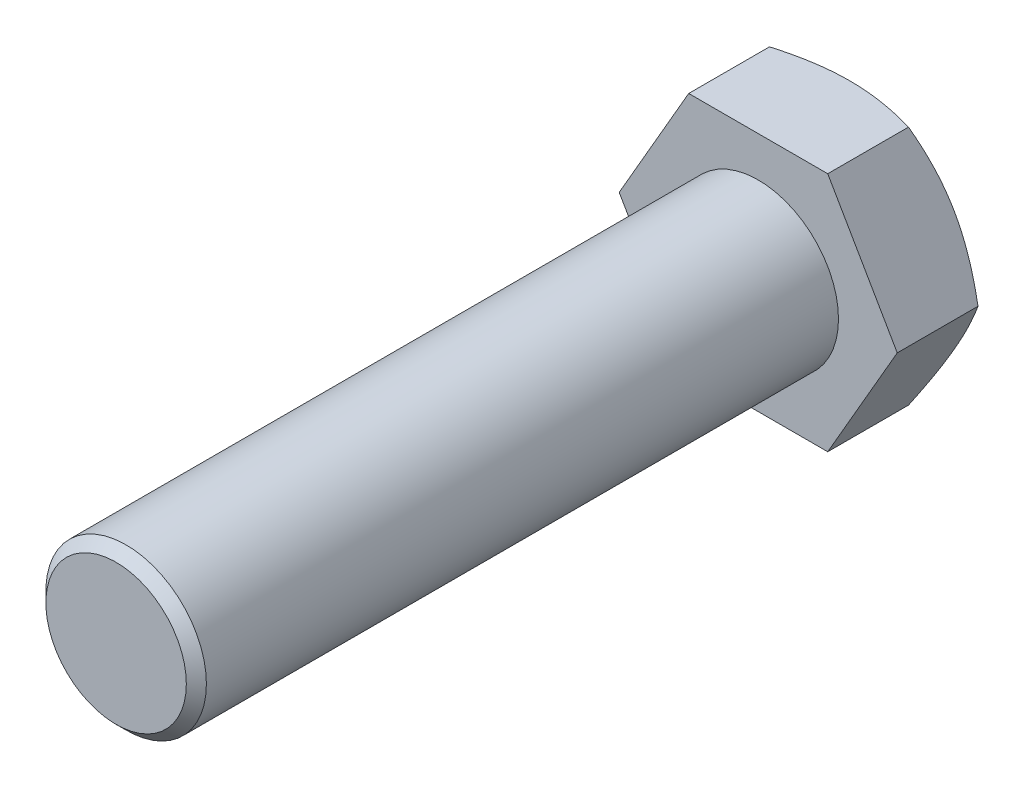
from build123d import *

# Parameters (mm, degrees)
HEAD_DEPTH         = 7.239
SKETCH2_R          = 6.35
SHAFT_DEPTH        = 50.8
SHAFT_CHAMFER_SIZE = 0.79375


with BuildPart() as part:
    # Head Sketch → Head (new body)
    with BuildSketch(Plane.XY):
        Polygon((10.998522628, 0), (5.499261314, 9.525), (-5.499261314, 9.525), (-10.998522628, 0), (-5.499261314, -9.525), (5.499261314, -9.525), align=None)
    extrude(amount=-HEAD_DEPTH)

    # Sketch9 → Head Chamfer (revolve, cut)
    with BuildSketch(Plane(origin=(0, 0, 0), x_dir=(1, 0, 0), z_dir=(0, 1, 0))):
        Polygon((10.998522628, 7.239), (9.525, 7.239), (10.998522628, 6.388261314), align=None)
    revolve(axis=Axis((0, 0, -10.14095), (0, 0, 1)), mode=Mode.SUBTRACT)

    # Sketch2 → Shaft (add)
    with BuildSketch(Plane.XY):
        Circle(SKETCH2_R)
    extrude(amount=SHAFT_DEPTH)

    # Shaft Chamfer
    shaft_chamfer_edges = [part.edges().sort_by_distance(p)[0] for p in [
        (-6.35, 0, 50.8),
    ]]
    chamfer(shaft_chamfer_edges, length=SHAFT_CHAMFER_SIZE)


solid = part.part
